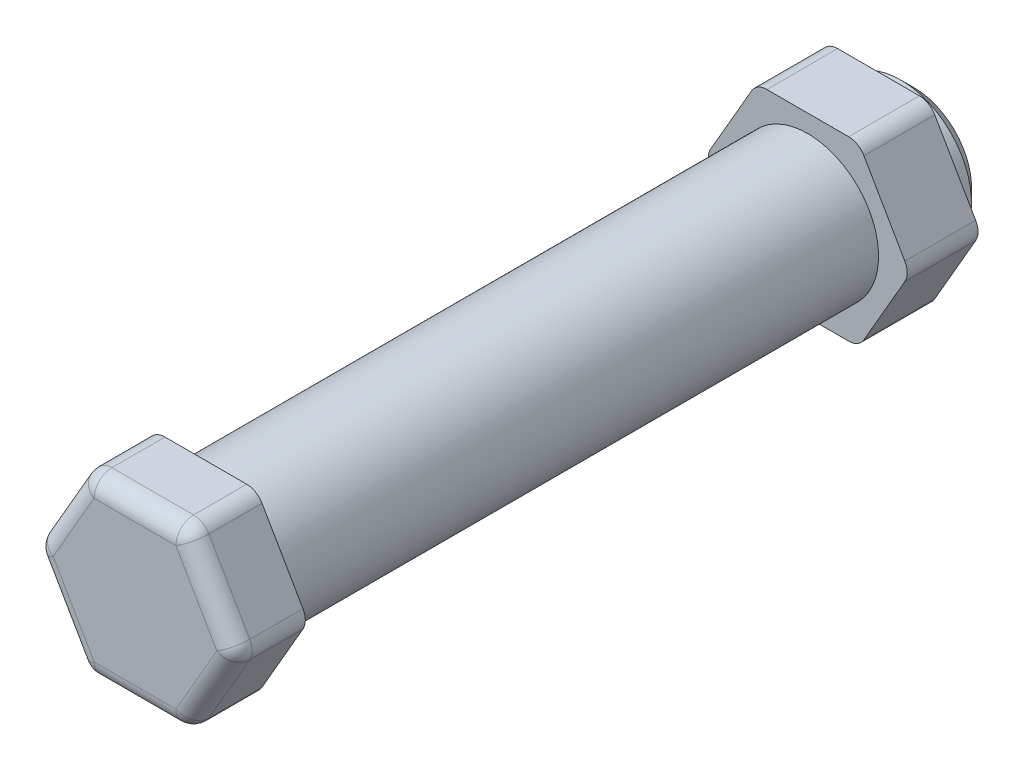
from build123d import *

# Parameters (mm, degrees)
EXTRUDE_1_DEPTH = 4
SKETCH_2_R      = 4
EXTRUDE_2_DEPTH = 34
EXTRUDE_3_DEPTH = 4
SKETCH_4_W      = 4
SKETCH_4_H      = 2
CHAMFER_1_SIZE  = 0.75
FILLET_1_R      = 1


with BuildPart() as part:
    # 草图1 → 凸台-拉伸1 (new body)
    with BuildSketch(Plane.XY.offset(21)):
        Polygon((-2.886751346, -5), (2.886751346, -5), (5.773502692, 0), (2.886751346, 5), (-2.886751346, 5), (-5.773502692, 0), align=None)
    extrude(amount=-EXTRUDE_1_DEPTH)

    # 草图2 → 凸台-拉伸2 (add)
    with BuildSketch(Plane(origin=(0, 0, 17), x_dir=(-1, 0, 0), z_dir=(0, 0, -1))):
        Circle(SKETCH_2_R)
    extrude(amount=EXTRUDE_2_DEPTH)

    # 草图3 → 凸台-拉伸3 (add)
    with BuildSketch(Plane.XY.offset(-17)):
        Polygon((-2.886751346, -5), (2.886751346, -5), (5.773502692, 0), (2.886751346, 5), (-2.886751346, 5), (-5.773502692, 0), align=None)
    extrude(amount=-EXTRUDE_3_DEPTH)

    # 草图4 → 旋转1 (revolve)
    with BuildSketch(Plane.XZ, mode=Mode.PRIVATE) as revolve_1_sk:
        with Locations((2, -22)):
            Rectangle(SKETCH_4_W, SKETCH_4_H)
    revolve(revolve_1_sk.sketch.rotate(Axis((0, 0, -21), (0, 0, -1)), 180), axis=Axis((0, 0, -21), (0, 0, -1)))

    # 倒角1
    chamfer_1_edges = [part.edges().sort_by_distance(p)[0] for p in [
        (4, 0, -23),
    ]]
    chamfer(chamfer_1_edges, length=CHAMFER_1_SIZE)

    # 圆角1
    fillet_1_edges = [part.edges().sort_by_distance(p)[0] for p in [
        (-5.773502692, 0, 19),
        (-2.886751346, 5, 19),
        (2.886751346, 5, 19),
        (5.773502692, 0, 19),
        (2.886751346, -5, 19),
        (-2.886751346, -5, 19),
        (-2.886751346, -5, -19),
        (-5.773502692, 0, -19),
        (-2.886751346, 5, -19),
        (2.886751346, 5, -19),
        (5.773502692, 0, -19),
        (2.886751346, -5, -19),
        (-4.330127019, 2.5, 21),
        (0, 5, 21),
        (4.330127019, 2.5, 21),
        (4.330127019, -2.5, 21),
        (0, -5, 21),
        (-4.330127019, -2.5, 21),
    ]]
    fillet(fillet_1_edges, radius=FILLET_1_R)


solid = part.part
